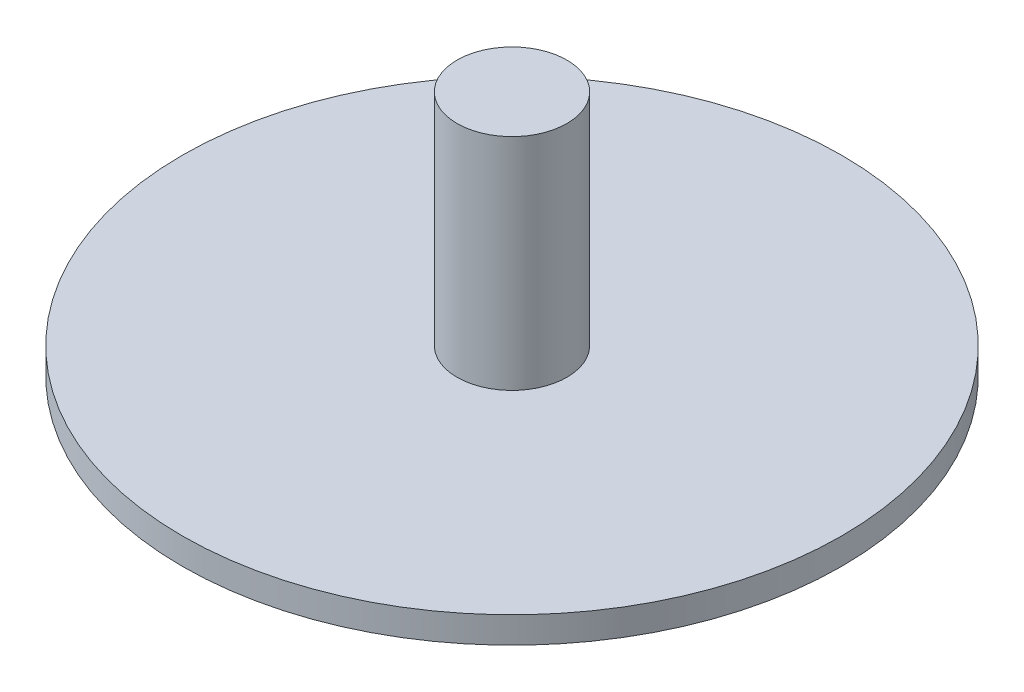
from build123d import *

# Parameters (mm, degrees)
SKETCH1_R           = 150
BOSS_EXTRUDE1_DEPTH = 12
SKETCH4_R           = 25
BOSS_EXTRUDE2_DEPTH = 100


with BuildPart() as part:
    # Sketch1 → Boss-Extrude1 (new body)
    with BuildSketch(Plane(origin=(0, 0, 0), x_dir=(1, 0, 0), z_dir=(0, 1, 0))):
        with Locations(Location((0, 0, 0), (0, 0, 270))):
            Circle(SKETCH1_R)
    extrude(amount=BOSS_EXTRUDE1_DEPTH)

    # Sketch4 → Boss-Extrude2 (add)
    with BuildSketch(Plane(origin=(0, 12, 0), x_dir=(1, 0, 0), z_dir=(0, 1, 0))):
        with Locations(Location((0, 0, 0), (0, 0, 270))):
            Circle(SKETCH4_R)
    extrude(amount=BOSS_EXTRUDE2_DEPTH)


solid = part.part
